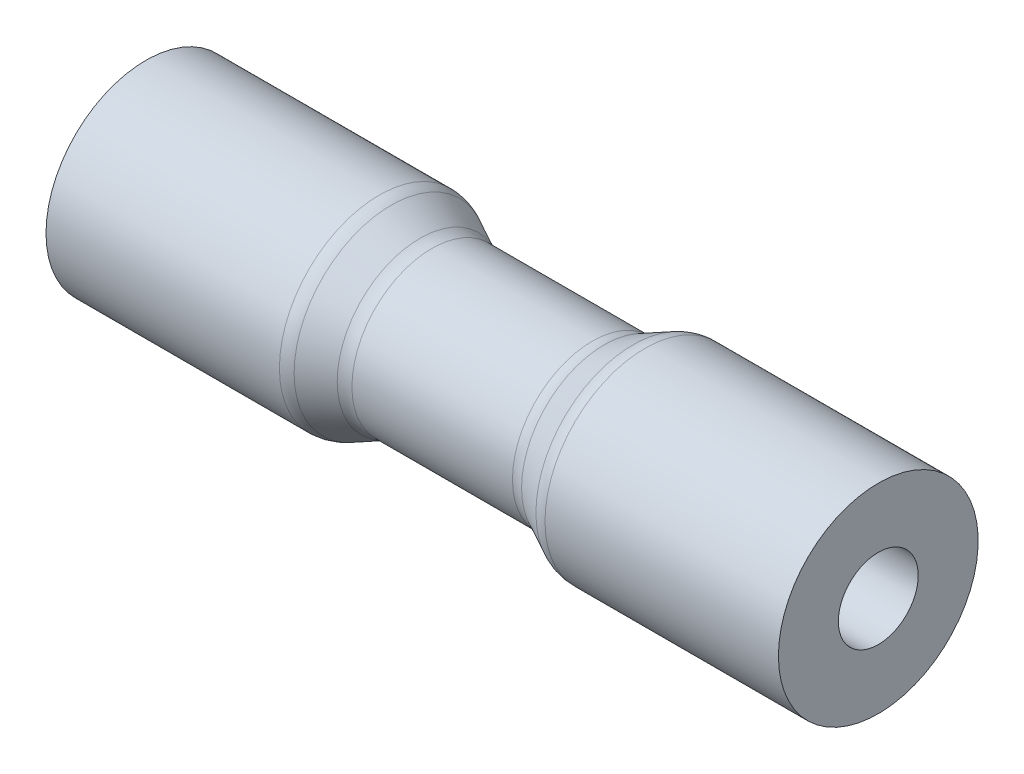
from build123d import *


with BuildPart() as part:
    # Sketch1 → Revolve1 (revolve)
    with BuildSketch(Plane.XY):
        with BuildLine():
            Line((-14.5, 0), (14.5, 0))
            Line((14.5, 0), (14.5, 3))
            Line((14.5, 3), (27.5, 3))
            Line((27.5, 3), (27.5, 7.5))
            Line((27.5, 7.5), (9.972135955, 7.5))
            ThreePointArc((9.972135955, 7.5), (9.512630114, 7.446497979), (9.077708764, 7.288854382))
            Line((9.077708764, 7.288854382), (6.922291236, 6.211145618))
            ThreePointArc((6.922291236, 6.211145618), (6.487369886, 6.053502021), (6.027864045, 6))
            Line((6.027864045, 6), (-6.027864045, 6))
            ThreePointArc((-6.027864045, 6), (-6.487369886, 6.053502021), (-6.922291236, 6.211145618))
            Line((-6.922291236, 6.211145618), (-9.077708764, 7.288854382))
            ThreePointArc((-9.077708764, 7.288854382), (-9.512630114, 7.446497979), (-9.972135955, 7.5))
            Line((-9.972135955, 7.5), (-27.5, 7.5))
            Line((-27.5, 7.5), (-27.5, 3))
            Line((-27.5, 3), (-14.5, 3))
            Line((-14.5, 3), (-14.5, 0))
        make_face()
    revolve(axis=Axis((-44.087306847, 0, 0), (1, 0, 0)))


solid = part.part
